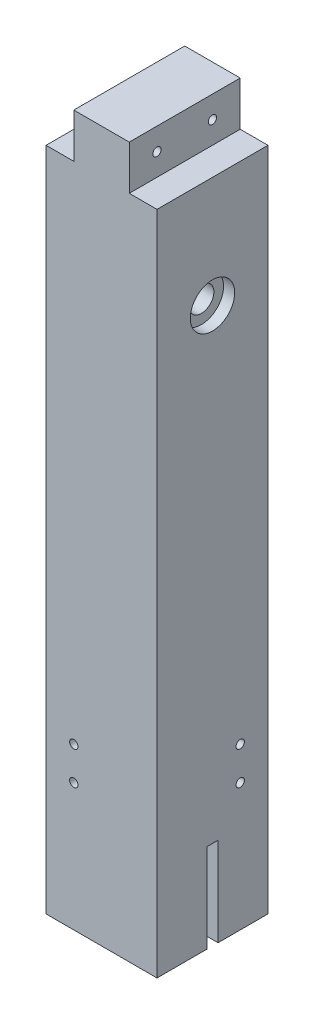
from build123d import *

# Parameters (mm, degrees)
BOSS_EXTRUDE1_DEPTH = 127
SKETCH2_W           = 12.7
SKETCH2_H           = 101.6
SKETCH2_R           = 14.2875
SKETCH2_R_2         = 4.7625
CUT_EXTRUDE1_DEPTH  = 468.663597044
SKETCH3_W           = 31.75
SKETCH3_H           = 76.2
CUT_EXTRUDE2_DEPTH  = 63.5
SKETCH2_3_R         = 25.4
SKETCH2_3_R_2       = 14.2875
CUT_EXTRUDE3_DEPTH  = 12.7
SKETCH4_R           = 4.7625
CUT_EXTRUDE4_DEPTH  = 69.85
SKETCH5_W           = 31.75
SKETCH5_H           = 76.2
CUT_EXTRUDE6_DEPTH  = 63.246
SKETCH6_R           = 4.7625
CUT_EXTRUDE7_DEPTH  = 69.85


with BuildPart() as part:
    # Sketch1 → Boss-Extrude1 (new body)
    with BuildSketch(Plane.XY):
        Polygon((63.5, -381), (63.5, 381), (31.75, 381), (31.75, 431.8), (-31.75, 431.8), (-31.75, 381), (-63.5, 381), (-63.5, -381), align=None)
    extrude(amount=BOSS_EXTRUDE1_DEPTH)

    # Sketch2 → Cut-Extrude1 (cut, through all)
    with BuildSketch(Plane(origin=(63.5, 0, 0), x_dir=(0, 0, -1), z_dir=(1, 0, 0))):
        with Locations((-63.5, -330.2)):
            Rectangle(SKETCH2_W, SKETCH2_H)
        with Locations((-63.5, 254)):
            Circle(SKETCH2_R)
        with Locations((-95.25, 406.4)):
            Circle(SKETCH2_R_2)
        with Locations((-31.75, 406.4)):
            Circle(SKETCH2_R_2)
    extrude(amount=-CUT_EXTRUDE1_DEPTH, mode=Mode.SUBTRACT)

    # Sketch3 → Cut-Extrude2 (cut)
    with BuildSketch(Plane(origin=(0, 0, 0), x_dir=(-1, 0, 0), z_dir=(0, 0, -1))):
        with Locations((-15.875, -215.9)):
            Rectangle(SKETCH3_W, SKETCH3_H)
    extrude(amount=-CUT_EXTRUDE2_DEPTH, mode=Mode.SUBTRACT)

    # Sketch2<3> → Cut-Extrude3 (cut)
    with BuildSketch(Plane(origin=(63.5, 0, 0), x_dir=(0, 0, -1), z_dir=(1, 0, 0))):
        with Locations((-63.5, 254)):
            Circle(SKETCH2_3_R)
        with Locations((-63.5, 254)):
            Circle(SKETCH2_3_R_2, mode=Mode.SUBTRACT)
    extrude(amount=-CUT_EXTRUDE3_DEPTH, mode=Mode.SUBTRACT)

    # Sketch4 → Cut-Extrude4 (cut)
    with BuildSketch(Plane(origin=(63.5, 0, 0), x_dir=(0, 0, -1), z_dir=(1, 0, 0))):
        with Locations((-31.75, -196.85)):
            Circle(SKETCH4_R)
        with Locations((-31.75, -234.95)):
            Circle(SKETCH4_R)
    extrude(amount=-CUT_EXTRUDE4_DEPTH, mode=Mode.SUBTRACT)

    # Sketch5 → Cut-Extrude6 (cut)
    with BuildSketch(Plane.ZY.offset(63.5)):
        with Locations((79.375, -215.9)):
            Rectangle(SKETCH5_W, SKETCH5_H)
    extrude(amount=-CUT_EXTRUDE6_DEPTH, mode=Mode.SUBTRACT)

    # Sketch6 → Cut-Extrude7 (cut)
    with BuildSketch(Plane.XY.offset(127)):
        with Locations((-31.75, -196.85)):
            Circle(SKETCH6_R)
        with Locations((-31.75, -234.95)):
            Circle(SKETCH6_R)
    extrude(amount=-CUT_EXTRUDE7_DEPTH, mode=Mode.SUBTRACT)


solid = part.part
